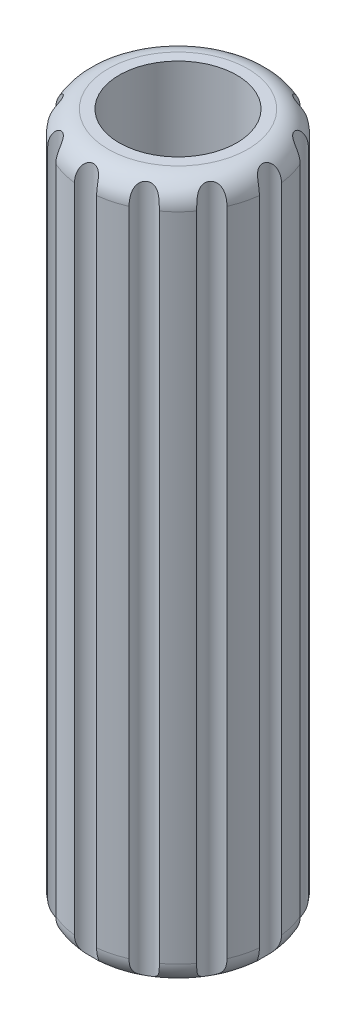
from build123d import *

# Parameters (mm, degrees)
SKETCH1_R               = 16
BOSS_EXTRUDE1_DEPTH     = 120
FILLET1_R               = 4
CUT_EXTRUDE1_DEPTH      = 123.11470018
CUT_EXTRUDE1_DEPTH_BACK = 116
SKETCH2_R               = 10.1
SKETCH3_R               = 2
CUT_EXTRUDE2_DEPTH      = 123.11470018


with BuildPart() as part:
    # Sketch1 → Boss-Extrude1 (new body)
    with BuildSketch(Plane(origin=(0, 0, 0), x_dir=(1, 0, 0), z_dir=(0, 1, 0))):
        with Locations(Location((0, 0, 0), (0, 0, 270))):
            Circle(SKETCH1_R)
    extrude(amount=BOSS_EXTRUDE1_DEPTH)

    # Fillet1
    fillet1_edges = [part.edges().sort_by_distance(p)[0] for p in [
        (0, 0, -16),
        (0, 120, -16),
    ]]
    fillet(fillet1_edges, radius=FILLET1_R)

    # Sketch2 → Cut-Extrude1 (cut, two sides: drawn at the far end of the back side and taken through both)
    with BuildSketch(Plane(origin=(0, 120, 0), x_dir=(1, 0, 0), z_dir=(0, 1, 0)).offset(-CUT_EXTRUDE1_DEPTH_BACK)):
        with Locations(Location((0, 0, 0), (0, 0, 270))):
            Circle(SKETCH2_R)
    extrude(amount=CUT_EXTRUDE1_DEPTH + CUT_EXTRUDE1_DEPTH_BACK, mode=Mode.SUBTRACT)

    # Sketch3 → Cut-Extrude2 (cut, through all)
    with BuildSketch(Plane(origin=(0, 0, 0), x_dir=(1, 0, 0), z_dir=(0, 1, 0))):
        with Locations((0, 16.5)):
            Circle(SKETCH3_R)
        with Locations((8.25, 14.289419162)):
            Circle(SKETCH3_R)
        with Locations((14.289419162, 8.25)):
            Circle(SKETCH3_R)
        with Locations((16.5, 0)):
            Circle(SKETCH3_R)
        with Locations((14.289419162, -8.25)):
            Circle(SKETCH3_R)
        with Locations((8.25, -14.289419162)):
            Circle(SKETCH3_R)
        with Locations((0, -16.5)):
            Circle(SKETCH3_R)
        with Locations((-8.25, -14.289419162)):
            Circle(SKETCH3_R)
        with Locations((-14.289419162, -8.25)):
            Circle(SKETCH3_R)
        with Locations((-16.5, 0)):
            Circle(SKETCH3_R)
        with Locations((-14.289419162, 8.25)):
            Circle(SKETCH3_R)
        with Locations((-8.25, 14.289419162)):
            Circle(SKETCH3_R)
    extrude(amount=CUT_EXTRUDE2_DEPTH, mode=Mode.SUBTRACT)


solid = part.part
